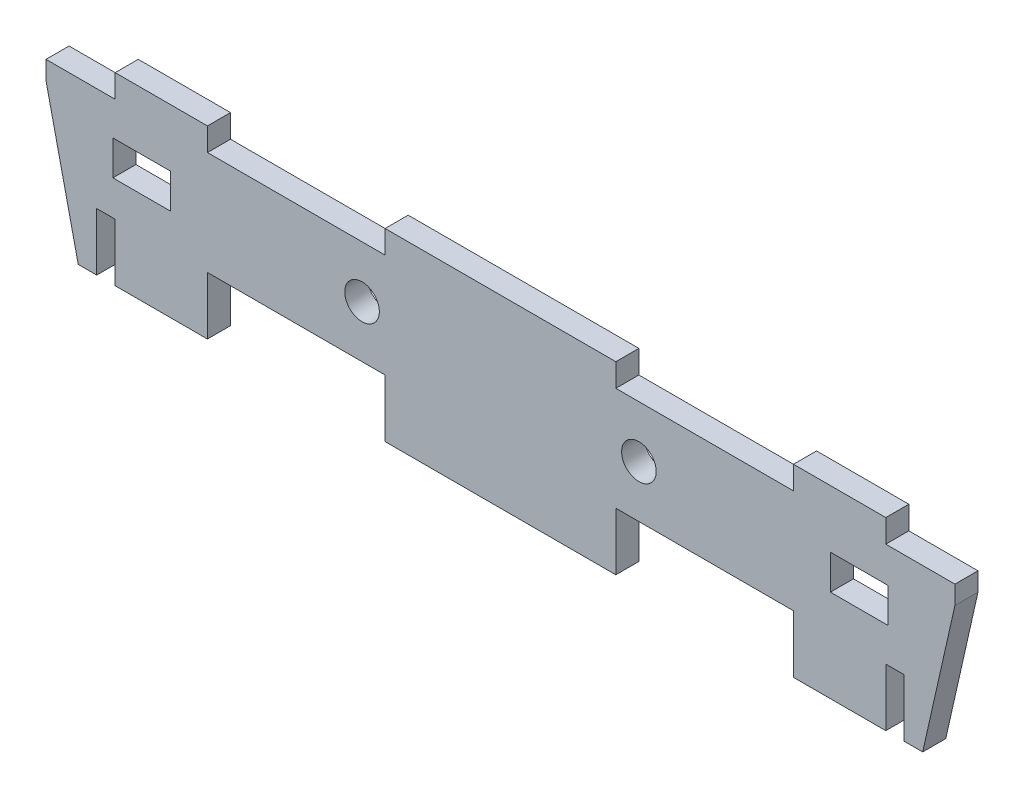
from build123d import *

# Parameters (mm, degrees)
SKETCH1_W           = 5
SKETCH1_H           = 3
BOSS_EXTRUDE1_DEPTH = 2
CUT_EXTRUDE1_REACH  = 53.173
SKETCH2_R           = 1.5


with BuildPart() as part:
    # Sketch1 → Boss-Extrude1 (new body)
    with BuildSketch(Plane.XY):
        Polygon((33.4, -27.6), (33.4, -32.6), (25.4, -32.6), (25.4, -27.6), (10, -27.6), (10, -32.6), (-10, -32.6), (-10, -27.6), (-25.4, -27.6), (-25.4, -32.6), (-33.4, -32.6), (-33.4, -27.6), (-35, -27.6), (-35, -32.6), (-36.6, -32.6), (-39.394660298, -20.2), (-39.394660298, -18.6), (-33.4, -18.6), (-33.4, -16.6), (-25.4, -16.6), (-25.4, -18.6), (-10, -18.6), (-10, -16.6), (10, -16.6), (10, -18.6), (25.4, -18.6), (25.4, -16.6), (33.4, -16.6), (33.4, -18.6), (39.394660298, -18.6), (39.394660298, -20.2), (36.6, -32.6), (35, -32.6), (35, -27.6), align=None)
        with Locations((31.1, -23.1)):
            Rectangle(SKETCH1_W, SKETCH1_H, mode=Mode.SUBTRACT)
        with Locations((-31.1, -23.1)):
            Rectangle(SKETCH1_W, SKETCH1_H, mode=Mode.SUBTRACT)
    extrude(amount=BOSS_EXTRUDE1_DEPTH)

    # Sketch2 → Cut-Extrude1 (cut, up to next)
    with BuildSketch(Plane.XY.offset(2), mode=Mode.PRIVATE) as cut_extrude1_sk1:
        with Locations((12, -23.1)):
            Circle(SKETCH2_R)
    cut_extrude1_tool1 = extrude(cut_extrude1_sk1.sketch, amount=-CUT_EXTRUDE1_REACH, mode=Mode.PRIVATE) & part.part
    # Sketch2 → Cut-Extrude1 (cut, up to next)
    with BuildSketch(Plane.XY.offset(2), mode=Mode.PRIVATE) as cut_extrude1_sk2:
        with Locations((-12, -23.1)):
            Circle(SKETCH2_R)
    cut_extrude1_tool2 = extrude(cut_extrude1_sk2.sketch, amount=-CUT_EXTRUDE1_REACH, mode=Mode.PRIVATE) & part.part
    add(cut_extrude1_tool1.solids().sort_by_distance((12, -23.1, 2))[0], mode=Mode.SUBTRACT)
    add(cut_extrude1_tool2.solids().sort_by_distance((-12, -23.1, 2))[0], mode=Mode.SUBTRACT)


solid = part.part
